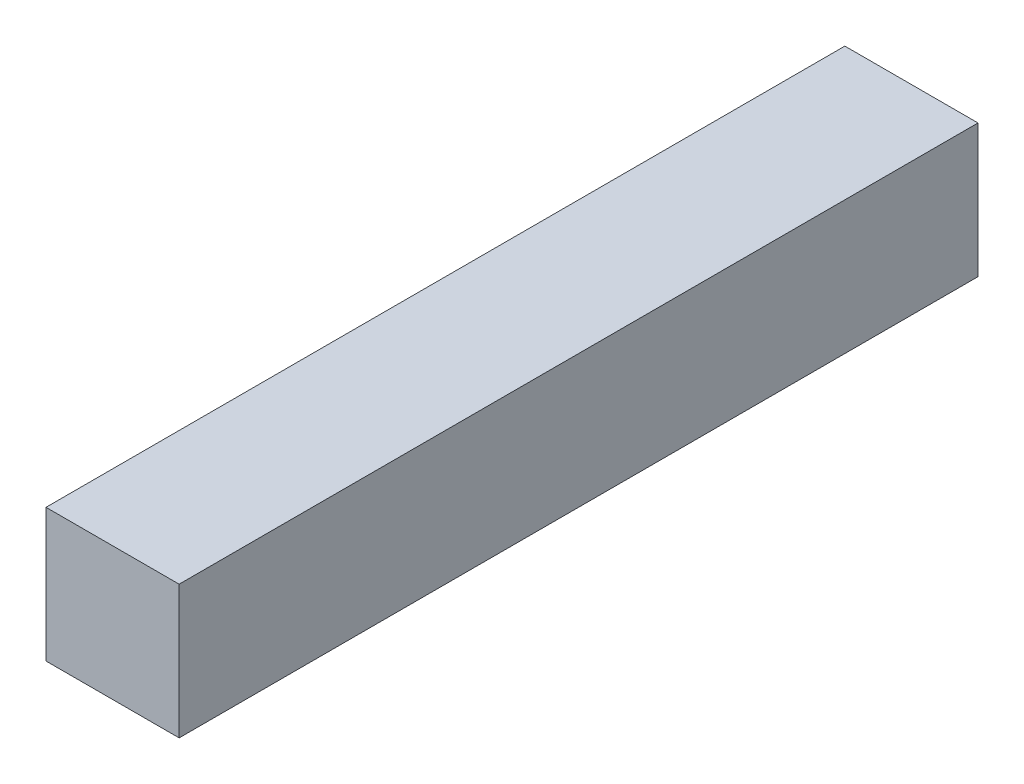
from build123d import *

# Parameters (mm, degrees)
SKETCH1_W           = 25.4
SKETCH1_H           = 25.4
BOSS_EXTRUDE1_DEPTH = 76.2


with BuildPart() as part:
    # Sketch1 → Boss-Extrude1 (new, symmetric)
    with BuildSketch(Plane.XY):
        Rectangle(SKETCH1_W, SKETCH1_H)
    extrude(amount=BOSS_EXTRUDE1_DEPTH, both=True)


solid = part.part
